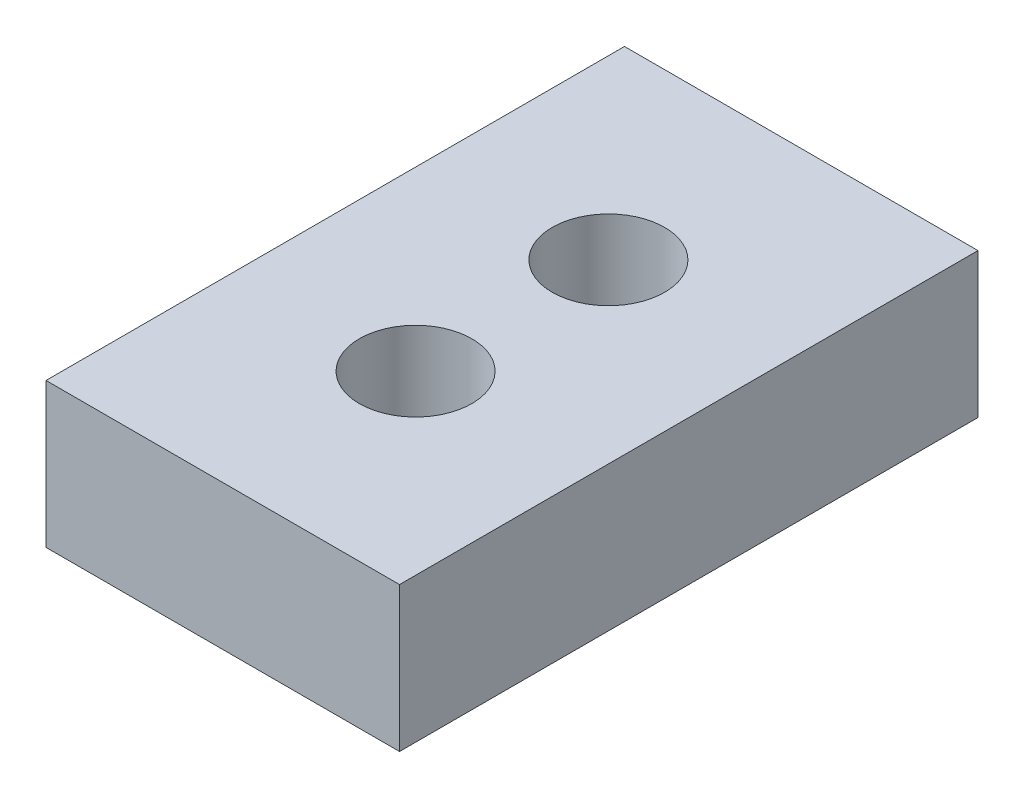
from build123d import *

# Parameters (mm, degrees)
SKETCH1_W           = 11
SKETCH1_H           = 18
BOSS_EXTRUDE1_DEPTH = 4.5
SKETCH2_R           = 1.75
CUT_EXTRUDE1_DEPTH  = 4.5


with BuildPart() as part:
    # Sketch1 → Boss-Extrude1 (new body)
    with BuildSketch(Plane(origin=(0, 0, 0), x_dir=(1, 0, 0), z_dir=(0, 1, 0))):
        Rectangle(SKETCH1_W, SKETCH1_H)
    extrude(amount=BOSS_EXTRUDE1_DEPTH)

    # Sketch2 → Cut-Extrude1 (cut)
    with BuildSketch(Plane(origin=(0, 4.5, 0), x_dir=(1, 0, 0), z_dir=(0, 1, 0))):
        with Locations(Location((0, -3, 0), (0, 0, 270))):
            Circle(SKETCH2_R)
        with Locations(Location((0, 3, 0), (0, 0, 270))):
            Circle(SKETCH2_R)
    extrude(amount=-CUT_EXTRUDE1_DEPTH, mode=Mode.SUBTRACT)


solid = part.part
